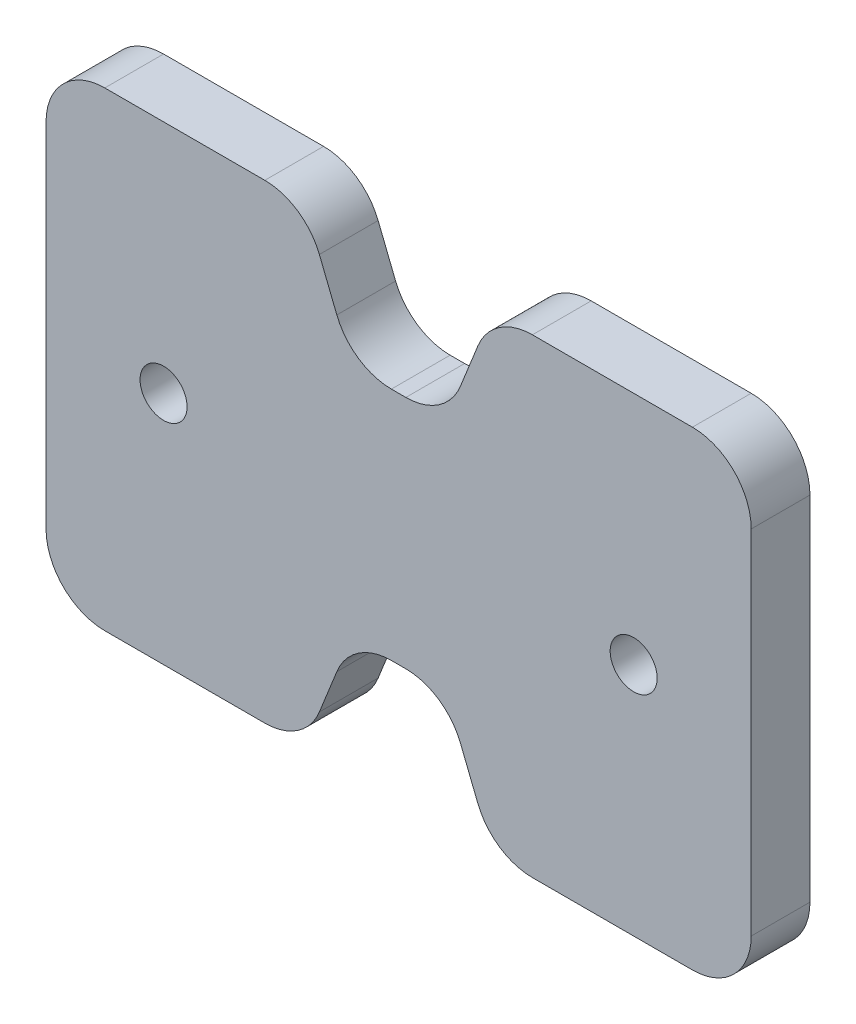
from build123d import *

# Parameters (mm, degrees)
ESQUISSE1_R        = 2
BOSS_EXTRU_1_DEPTH = 5
CONG_1_R           = 5


with BuildPart() as part:
    # Esquisse1 → Boss.-Extru.1 (new body)
    with BuildSketch(Plane.XY):
        Polygon((-30, 20), (-30, -20), (-8, -20), (-4, -10), (4, -10), (8, -20), (30, -20), (30, 20), (8, 20), (4, 10), (-4, 10), (-8, 20), align=None)
        with Locations((20, 0)):
            Circle(ESQUISSE1_R, mode=Mode.SUBTRACT)
        with Locations(Location((-20, 0, 0), (0, 0, 180))):
            Circle(ESQUISSE1_R, mode=Mode.SUBTRACT)
    extrude(amount=BOSS_EXTRU_1_DEPTH)

    # Congé1
    cong_1_edges = [part.edges().sort_by_distance(p)[0] for p in [
        (-8, 20, 2.5),
        (-4, 10, 2.5),
        (4, 10, 2.5),
        (8, 20, 2.5),
        (30, 20, 2.5),
        (30, -20, 2.5),
        (8, -20, 2.5),
        (4, -10, 2.5),
        (-4, -10, 2.5),
        (-8, -20, 2.5),
        (-30, -20, 2.5),
        (-30, 20, 2.5),
    ]]
    fillet(cong_1_edges, radius=CONG_1_R)


solid = part.part
